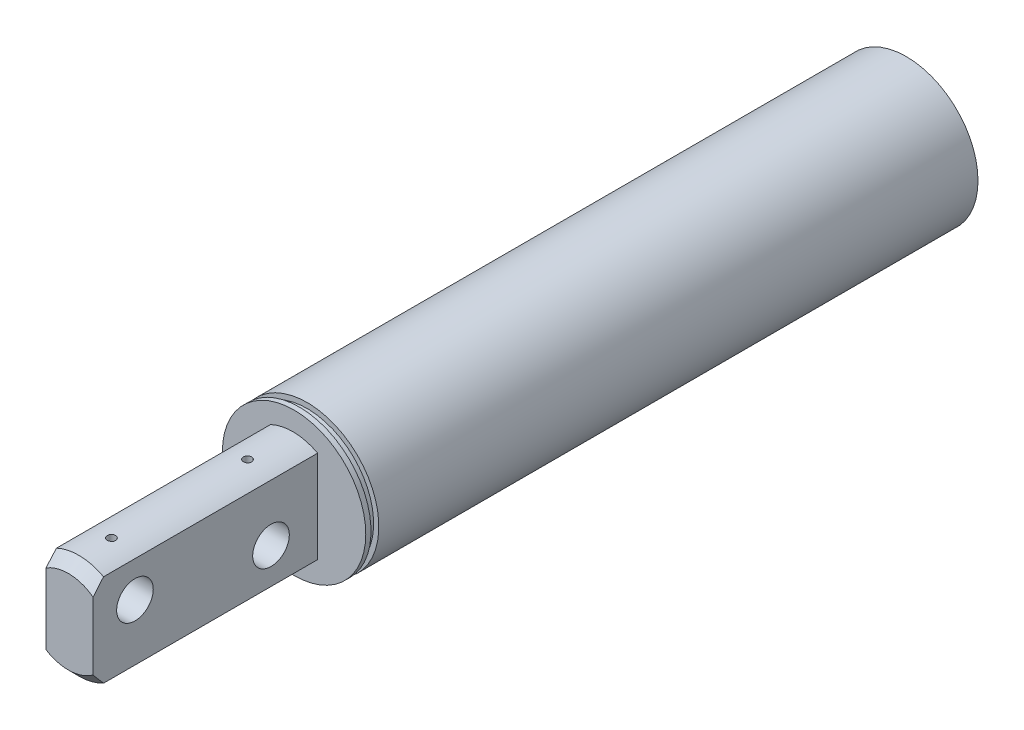
from build123d import *

# Parameters (mm, degrees)
SKETCH_1_R               = 13.7
EXTRUDE_1_DEPTH          = 117
SKETCH_6_W               = 1
SKETCH_6_H               = 1.5
HOLE_WIZARD_M12_1_D      = 10.2
HOLE_WIZARD_M12_1_DEPTH  = 82.25
HOLE_WIZARD_M12_1_TIP    = 3.064389157
SKETCH_9_R               = 10
EXTRUDE_3_DEPTH          = 42.91
CUT_EXTRUDE_1_DEPTH      = 162.079446547
CUT_EXTRUDE_1_DEPTH_BACK = 162.079446547
SKETCH_8_W               = 42.91
SKETCH_8_H               = 10.443945465
CHAMFER_1_SIZE           = 2
HOLE_WIZARD_7_0_7_1_D    = 7
HOLE_WIZARD_M2_1_REACH   = 164.236
HOLE_WIZARD_M2_1_BORE_R  = 0.8


with BuildPart() as part:
    # 草图1 → 凸台-拉伸1 (new body)
    with BuildSketch(Plane.XY):
        Circle(SKETCH_1_R)
    extrude(amount=EXTRUDE_1_DEPTH)

    # 草图6 → 切除-旋转1 (revolve, cut)
    with BuildSketch(Plane(origin=(0, 0, 0), x_dir=(1, 0, 0), z_dir=(0, 1, 0))):
        with Locations((-13.2, -115.25)):
            Rectangle(SKETCH_6_W, SKETCH_6_H)
    revolve(axis=Axis((0, 0, 0), (0, 0, 1)), mode=Mode.SUBTRACT)

    # M12 螺纹孔1
    with Locations(Plane(origin=(0, 0, 0), x_dir=(-1, 0, 0), z_dir=(0, 0, -1))):
        with Locations((0, 0)):
            Hole(HOLE_WIZARD_M12_1_D / 2, depth=HOLE_WIZARD_M12_1_DEPTH)
            with Locations((0, 0, -(HOLE_WIZARD_M12_1_DEPTH + HOLE_WIZARD_M12_1_TIP / 2))):  # 118° drill point
                Cone(0, HOLE_WIZARD_M12_1_D / 2, HOLE_WIZARD_M12_1_TIP, mode=Mode.SUBTRACT)

    # 草图9 → 凸台-拉伸3 (add)
    with BuildSketch(Plane.XY.offset(117)):
        with Locations((-0.231058247, 0)):
            Circle(SKETCH_9_R)
    extrude(amount=EXTRUDE_3_DEPTH)

    # 草图8 → 切除-拉伸1 (cut, two sides: drawn at the far end of the back side and taken through both)
    with BuildSketch(Plane(origin=(0, 0, 0), x_dir=(0, 0, -1), z_dir=(0, 1, 0)).offset(-CUT_EXTRUDE_1_DEPTH_BACK)):
        with Locations((-138.455, 9.721972732)):
            Rectangle(SKETCH_8_W, SKETCH_8_H)
        with Locations((-138.455, -9.721972732)):
            Rectangle(SKETCH_8_W, SKETCH_8_H)
    extrude(amount=CUT_EXTRUDE_1_DEPTH + CUT_EXTRUDE_1_DEPTH_BACK, mode=Mode.SUBTRACT)

    # 倒角1
    chamfer_1_edges = [part.edges().sort_by_distance(p)[0] for p in [
        (0.027699329, -9.996651665, 159.91),
        (0.027699329, 9.996651665, 159.91),
    ]]
    chamfer(chamfer_1_edges, length=CHAMFER_1_SIZE)

    # Ø7.0 (7) 直径孔1 (through all)
    with Locations(Plane(origin=(4.5, 0, 0), x_dir=(0, 0, -1), z_dir=(1, 0, 0))):
        with Locations((-125.91, -2), (-151.91, 2)):
            Hole(HOLE_WIZARD_7_0_7_1_D / 2)

    # M2 螺纹孔1 bore → M2 螺纹孔1 (cut, up to next)
    with BuildSketch(Plane(origin=(0, 10, 0), x_dir=(1, 0, 0), z_dir=(0, 1, 0)), mode=Mode.PRIVATE) as hole_wizard_m2_1_sk1:
        with Locations((0, -151.91)):
            Circle(HOLE_WIZARD_M2_1_BORE_R)
    hole_wizard_m2_1_tool1 = extrude(hole_wizard_m2_1_sk1.sketch, amount=-HOLE_WIZARD_M2_1_REACH, mode=Mode.PRIVATE) & part.part
    # M2 螺纹孔1 bore → M2 螺纹孔1 (cut, up to next)
    with BuildSketch(Plane(origin=(0, 10, 0), x_dir=(1, 0, 0), z_dir=(0, 1, 0)), mode=Mode.PRIVATE) as hole_wizard_m2_1_sk2:
        with Locations((0, -125.91)):
            Circle(HOLE_WIZARD_M2_1_BORE_R)
    hole_wizard_m2_1_tool2 = extrude(hole_wizard_m2_1_sk2.sketch, amount=-HOLE_WIZARD_M2_1_REACH, mode=Mode.PRIVATE) & part.part
    add(hole_wizard_m2_1_tool1.solids().sort_by_distance((0, 10, 151.91))[0], mode=Mode.SUBTRACT)
    add(hole_wizard_m2_1_tool2.solids().sort_by_distance((0, 10, 125.91))[0], mode=Mode.SUBTRACT)


solid = part.part
